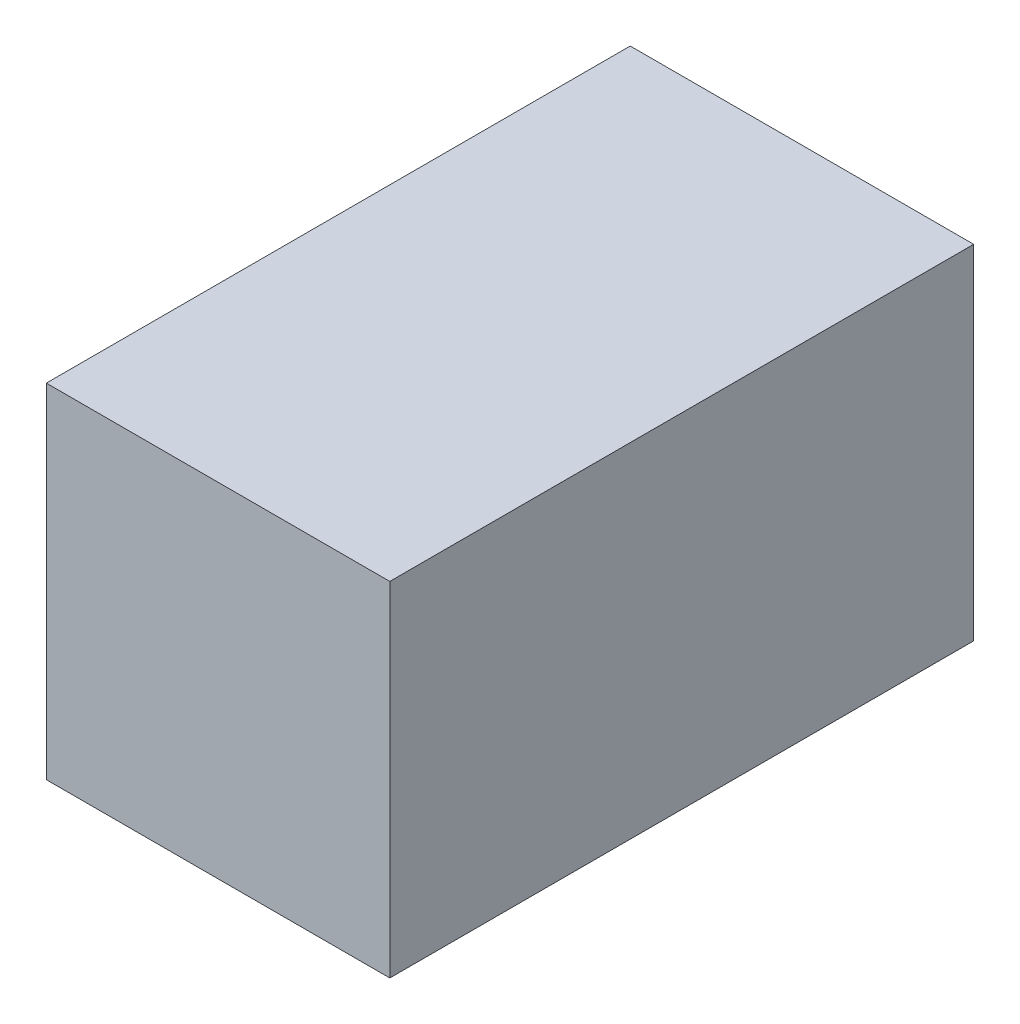
from build123d import *

# Parameters (mm, degrees)
SKETCH1_W           = 200
SKETCH1_H           = 200
BOSS_EXTRUDE1_DEPTH = 340


with BuildPart() as part:
    # Sketch1 → Boss-Extrude1 (new body)
    with BuildSketch(Plane.XY):
        Rectangle(SKETCH1_W, SKETCH1_H)
    extrude(amount=BOSS_EXTRUDE1_DEPTH)


solid = part.part
